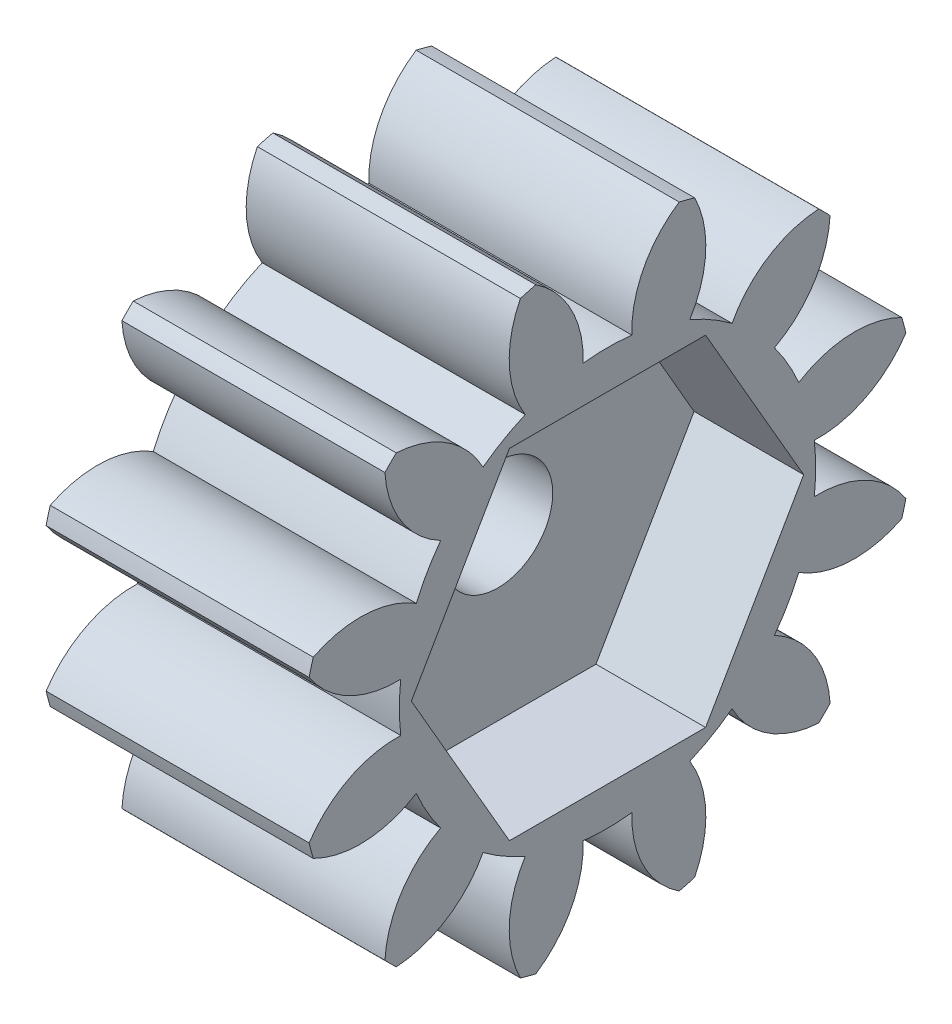
from build123d import *

# Parameters (mm, degrees)
BASPROSKE_W         = 12
BASPROSKE_H         = 14
TOOTHCUT_DEPTH      = 24.151673806
TEETHCUTS_COUNT     = 12
TEETHCUTS_ANGLE     = 330
BORSKE_R            = 2.5
BORE_DEPTH          = 50.0000508
CUT_EXTRUDE_1_DEPTH = 5


with BuildPart() as part:
    # BasProSke → Base-Revolve (revolve)
    with BuildSketch(Plane(origin=(0, 0, 0), x_dir=(1, 0, 0), z_dir=(0, 1, 0)), mode=Mode.PRIVATE) as base_revolve_sk:
        with Locations((6, 7)):
            Rectangle(BASPROSKE_W, BASPROSKE_H)
    revolve(base_revolve_sk.sketch.rotate(Axis((-10, 0, 0), (1, 0, 0)), 180), axis=Axis((-10, 0, 0), (1, 0, 0)))

    # TooCutSke → ToothCut (cut, through all)
    with BuildSketch(Plane(origin=(0, 0, 0), x_dir=(0, 0, -1), z_dir=(1, 0, 0))):
        with BuildLine():
            ThreePointArc((1.111908866, 9.433698091), (0, 9.499), (-1.111908866, 9.433698091))
            ThreePointArc((-1.111908866, 9.433698091), (-1.651516138, 11.821129337), (-3.298149691, 13.632096456))
            ThreePointArc((-3.298149691, 13.632096456), (0, 14.0254), (3.298149691, 13.632096456))
            ThreePointArc((3.298149691, 13.632096456), (1.651516138, 11.821129337), (1.111908866, 9.433698091))
        make_face()
    toothcut = extrude(amount=TOOTHCUT_DEPTH, mode=Mode.SUBTRACT)

    # TeethCuts: ToothCut ×12 about axis
    teethcuts_axis = Axis((-10, 0, 0), (1, 0, 0))
    for i in range(1, TEETHCUTS_COUNT):
        add(toothcut.rotate(teethcuts_axis, i * TEETHCUTS_ANGLE / (TEETHCUTS_COUNT - 1)), mode=Mode.SUBTRACT)

    # BorSke → Bore (cut, symmetric)
    with BuildSketch(Plane(origin=(0, 0, 0), x_dir=(0, 0, -1), z_dir=(1, 0, 0))):
        with Locations(Location((0, 0, 0), (0, 0, 180))):
            Circle(BORSKE_R)
    extrude(amount=BORE_DEPTH, both=True, mode=Mode.SUBTRACT)

    # Эскиз1 → Вырез-Вытянуть1 (cut)
    with BuildSketch(Plane(origin=(12, 0, 0), x_dir=(0, 0, -1), z_dir=(1, 0, 0))):
        Polygon((8.948929172, 0), (4.474464586, 7.75), (-4.474464586, 7.75), (-8.948929172, 0), (-4.474464586, -7.75), (4.474464586, -7.75), align=None)
    extrude(amount=-CUT_EXTRUDE_1_DEPTH, mode=Mode.SUBTRACT)


solid = part.part
